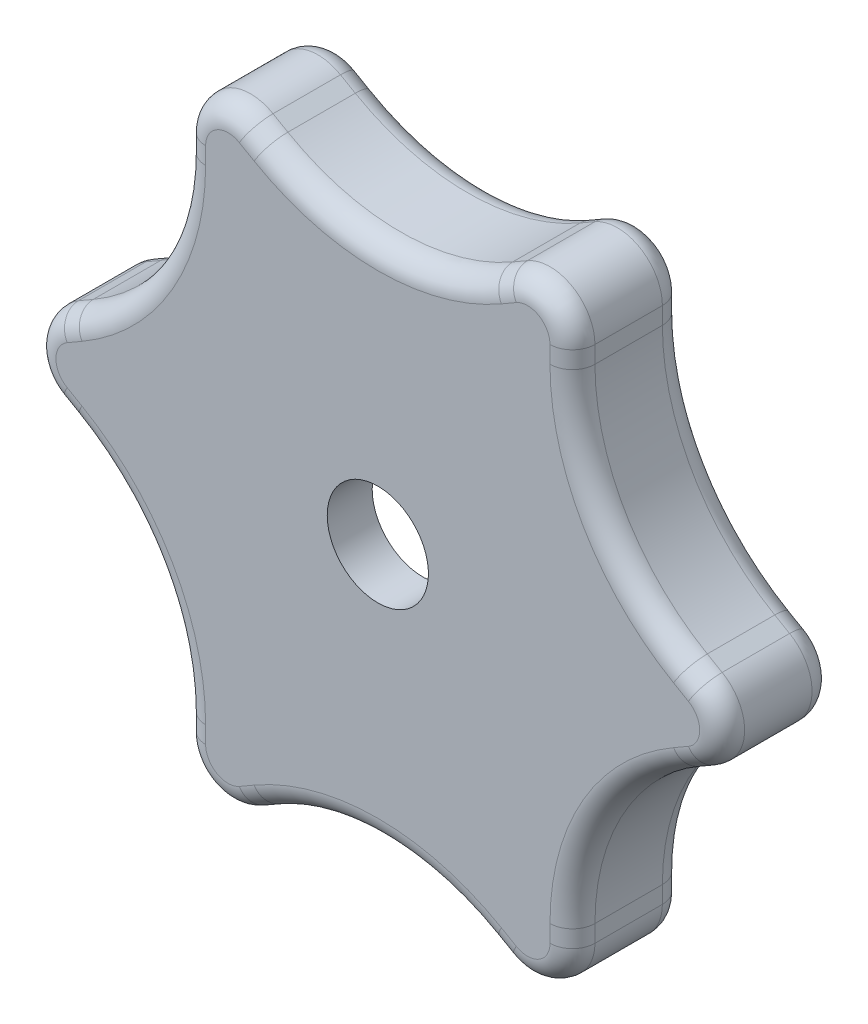
from build123d import *

# Parameters (mm, degrees)
EXTRUDE_1_DEPTH     = 5
SKETCH_2_R          = 10
CUT_EXTRUDE_1_DEPTH = 3
SKETCH_3_R          = 2.25
CUT_EXTRUDE_2_DEPTH = 3
FILLET_1_R          = 1


with BuildPart() as part:
    # 草图1 → 凸台-拉伸1 (new body)
    with BuildSketch(Plane.XY):
        with BuildLine():
            Line((-14.320508076, 1.732050808), (-13.660254038, 2.113248654))
            ThreePointArc((-13.660254038, 2.113248654), (-10, 5.773502692), (-8.660254038, 10.773502692))
            Line((-8.660254038, 10.773502692), (-8.660254038, 11.535898385))
            ThreePointArc((-8.660254038, 11.535898385), (-7.660254038, 13.267949192), (-5.660254038, 13.267949192))
            Line((-5.660254038, 13.267949192), (-5, 12.886751346))
            ThreePointArc((-5, 12.886751346), (0, 11.547005384), (5, 12.886751346))
            Line((5, 12.886751346), (5.660254038, 13.267949192))
            ThreePointArc((5.660254038, 13.267949192), (7.660254038, 13.267949192), (8.660254038, 11.535898385))
            Line((8.660254038, 11.535898385), (8.660254038, 10.773502692))
            ThreePointArc((8.660254038, 10.773502692), (10, 5.773502692), (13.660254038, 2.113248654))
            Line((13.660254038, 2.113248654), (14.320508076, 1.732050808))
            ThreePointArc((14.320508076, 1.732050808), (15.320508076, 0), (14.320508076, -1.732050808))
            Line((14.320508076, -1.732050808), (13.660254038, -2.113248654))
            ThreePointArc((13.660254038, -2.113248654), (10, -5.773502692), (8.660254038, -10.773502692))
            Line((8.660254038, -10.773502692), (8.660254038, -11.535898385))
            ThreePointArc((8.660254038, -11.535898385), (7.660254038, -13.267949192), (5.660254038, -13.267949192))
            Line((5.660254038, -13.267949192), (5, -12.886751346))
            ThreePointArc((5, -12.886751346), (0, -11.547005384), (-5, -12.886751346))
            Line((-5, -12.886751346), (-5.660254038, -13.267949192))
            ThreePointArc((-5.660254038, -13.267949192), (-7.660254038, -13.267949192), (-8.660254038, -11.535898385))
            Line((-8.660254038, -11.535898385), (-8.660254038, -10.773502692))
            ThreePointArc((-8.660254038, -10.773502692), (-10, -5.773502692), (-13.660254038, -2.113248654))
            Line((-13.660254038, -2.113248654), (-14.320508076, -1.732050808))
            ThreePointArc((-14.320508076, -1.732050808), (-15.320508076, 0), (-14.320508076, 1.732050808))
        make_face()
    extrude(amount=EXTRUDE_1_DEPTH)

    # 草图2 → 切除-拉伸1 (cut)
    with BuildSketch(Plane(origin=(0, 0, 0), x_dir=(-1, 0, 0), z_dir=(0, 0, -1))):
        Circle(SKETCH_2_R)
    extrude(amount=-CUT_EXTRUDE_1_DEPTH, mode=Mode.SUBTRACT)

    # 草图3 → 切除-拉伸2 (cut)
    with BuildSketch(Plane(origin=(0, 0, 3), x_dir=(-1, 0, 0), z_dir=(0, 0, -1))):
        Circle(SKETCH_3_R)
    extrude(amount=-CUT_EXTRUDE_2_DEPTH, mode=Mode.SUBTRACT)

    # 圆角1
    fillet_1_edges = [part.edges().sort_by_distance(p)[0] for p in [
        (-7.660254038, -13.267949192, 5),
        (-5.330127019, -13.077350269, 5),
        (0, -11.547005384, 5),
        (-13.990381057, -1.922649731, 0),
        (-15.320508076, 0, 0),
        (-13.990381057, 1.922649731, 0),
        (-10, 5.773502692, 0),
        (-8.660254038, 11.154700538, 0),
        (5.330127019, -13.077350269, 5),
        (-7.660254038, 13.267949192, 0),
        (-5.330127019, 13.077350269, 0),
        (0, 11.547005384, 0),
        (5.330127019, 13.077350269, 0),
        (7.660254038, 13.267949192, 0),
        (8.660254038, 11.154700538, 0),
        (10, 5.773502692, 0),
        (13.990381057, 1.922649731, 0),
        (15.320508076, 0, 0),
        (13.990381057, -1.922649731, 0),
        (7.660254038, -13.267949192, 5),
        (10, -5.773502692, 0),
        (8.660254038, -11.154700538, 0),
        (7.660254038, -13.267949192, 0),
        (5.330127019, -13.077350269, 0),
        (0, -11.547005384, 0),
        (-5.330127019, -13.077350269, 0),
        (-7.660254038, -13.267949192, 0),
        (-8.660254038, -11.154700538, 0),
        (-10, -5.773502692, 0),
        (8.660254038, -11.154700538, 5),
        (10, -5.773502692, 5),
        (13.990381057, -1.922649731, 5),
        (15.320508076, 0, 5),
        (13.990381057, 1.922649731, 5),
        (-10, -5.773502692, 5),
        (10, 5.773502692, 5),
        (8.660254038, 11.154700538, 5),
        (7.660254038, 13.267949192, 5),
        (5.330127019, 13.077350269, 5),
        (0, 11.547005384, 5),
        (-5.330127019, 13.077350269, 5),
        (-7.660254038, 13.267949192, 5),
        (-8.660254038, 11.154700538, 5),
        (-10, 5.773502692, 5),
        (-13.990381057, 1.922649731, 5),
        (-8.660254038, -11.154700538, 5),
        (-15.320508076, 0, 5),
        (-13.990381057, -1.922649731, 5),
    ]]
    fillet(fillet_1_edges, radius=FILLET_1_R)


solid = part.part
